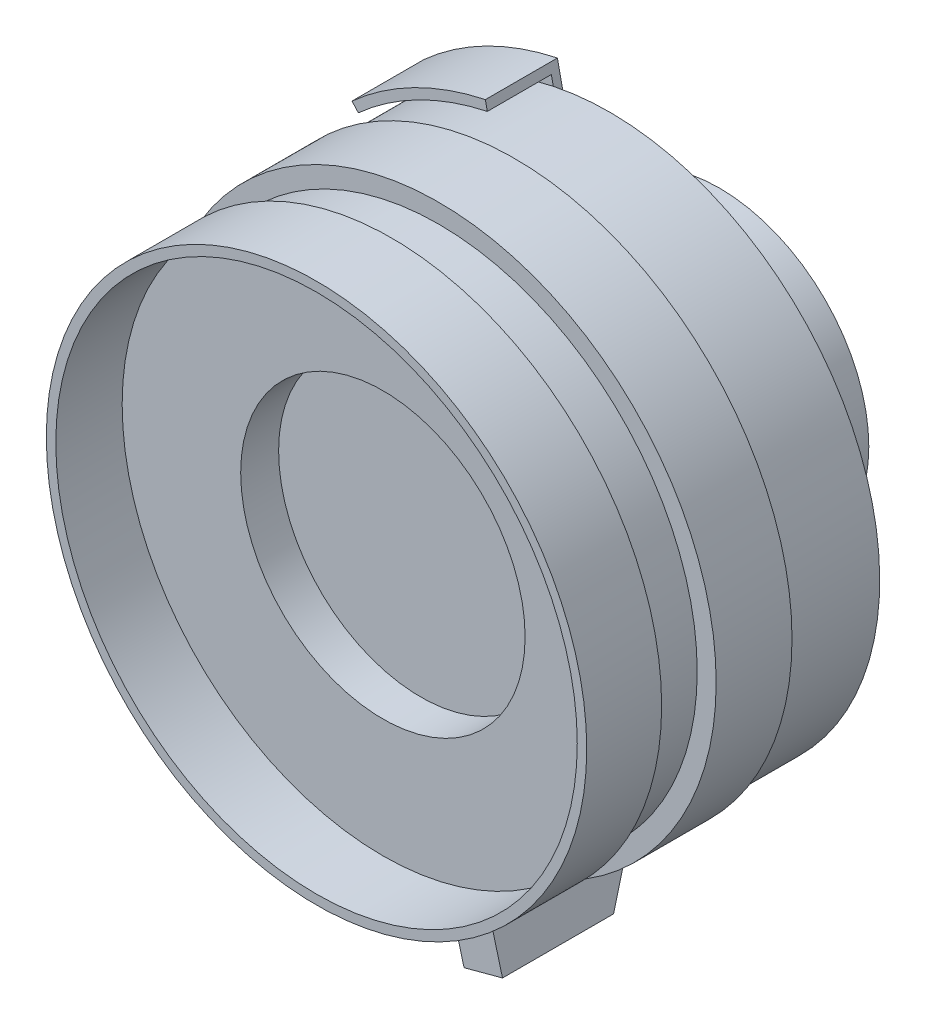
from build123d import *

# Parameters (mm, degrees)
SKETCH_1_R          = 15.75
EXTRUDE_1_DEPTH     = 4.5
SKETCH_2_R          = 16.3
EXTRUDE_2_DEPTH     = 6
SKETCH_3_R          = 19
EXTRUDE_3_DEPTH     = 0.5
SKETCH_4_R          = 24
EXTRUDE_4_DEPTH     = 0.6
SKETCH_5_R          = 28.5
EXTRUDE_5_DEPTH     = 10
SKETCH_6_R          = 0.8
EXTRUDE_6_DEPTH     = 1.2
SKETCH_7_R          = 29.25
EXTRUDE_7_DEPTH     = 8
SKETCH_8_R          = 27.25
EXTRUDE_8_DEPTH     = 5
SKETCH_9_R          = 28.5
EXTRUDE_9_DEPTH     = 7.9
SKETCH_10_R         = 14.75
CUT_EXTRUDE_1_DEPTH = 1
SKETCH_11_R         = 27.5
CUT_EXTRUDE_2_DEPTH = 7
SKETCH_12_R         = 15
CUT_EXTRUDE_3_DEPTH = 4
EXTRUDE_10_DEPTH    = 0.85
EXTRUDE_START       = 6.75
EXTRUDE_11_DEPTH    = 6.75
EXTRUDE_12_DEPTH    = 8.6
EXTRUDE_16_DEPTH    = 4.2


with BuildPart() as part:
    # 草图1 → 凸台-拉伸1 (new body)
    with BuildSketch(Plane.XY):
        Circle(SKETCH_1_R)
    extrude(amount=EXTRUDE_1_DEPTH)

    # 草图2 → 凸台-拉伸2 (add)
    with BuildSketch(Plane.XY.offset(4.5)):
        Circle(SKETCH_2_R)
    extrude(amount=EXTRUDE_2_DEPTH)

    # 草图3 → 凸台-拉伸3 (add)
    with BuildSketch(Plane.XY.offset(10.5)):
        Circle(SKETCH_3_R)
    extrude(amount=EXTRUDE_3_DEPTH)

    # 草图4 → 凸台-拉伸4 (add)
    with BuildSketch(Plane.XY.offset(11)):
        Circle(SKETCH_4_R)
    extrude(amount=EXTRUDE_4_DEPTH)

    # 草图5 → 凸台-拉伸5 (add)
    with BuildSketch(Plane.XY.offset(11.6)):
        Circle(SKETCH_5_R)
    extrude(amount=EXTRUDE_5_DEPTH)

    # 草图6 → 凸台-拉伸6 (add)
    with BuildSketch(Plane(origin=(0, 0, 10.5), x_dir=(-1, 0, 0), z_dir=(0, 0, -1))):
        with Locations(Location((4.658742812, 17.386664873, 0), (0, 0, 180))):
            Circle(SKETCH_6_R)
    extrude(amount=EXTRUDE_6_DEPTH)

    # 草图7 → 凸台-拉伸7 (add)
    with BuildSketch(Plane.XY.offset(21.6)):
        Circle(SKETCH_7_R)
    extrude(amount=EXTRUDE_7_DEPTH)

    # 草图8 → 凸台-拉伸8 (add)
    with BuildSketch(Plane.XY.offset(29.6)):
        Circle(SKETCH_8_R)
    extrude(amount=EXTRUDE_8_DEPTH)

    # 草图9 → 凸台-拉伸9 (add)
    with BuildSketch(Plane.XY.offset(34.6)):
        Circle(SKETCH_9_R)
    extrude(amount=EXTRUDE_9_DEPTH)

    # 草图10 → 切除-拉伸1 (cut)
    with BuildSketch(Plane(origin=(0, 0, 0), x_dir=(-1, 0, 0), z_dir=(0, 0, -1))):
        Circle(SKETCH_10_R)
    extrude(amount=-CUT_EXTRUDE_1_DEPTH, mode=Mode.SUBTRACT)

    # 草图11 → 切除-拉伸2 (cut)
    with BuildSketch(Plane.XY.offset(42.5)):
        Circle(SKETCH_11_R)
    extrude(amount=-CUT_EXTRUDE_2_DEPTH, mode=Mode.SUBTRACT)

    # 草图12 → 切除-拉伸3 (cut)
    with BuildSketch(Plane.XY.offset(35.5)):
        Circle(SKETCH_12_R)
    extrude(amount=-CUT_EXTRUDE_3_DEPTH, mode=Mode.SUBTRACT)

    # 草图13 → 凸台-拉伸10 (add)
    with BuildSketch(Plane(origin=(0, 0, 11.6), x_dir=(-1, 0, 0), z_dir=(0, 0, -1))):
        with BuildLine():
            Line((6.34130657, 29.833501822), (5.093836425, 23.964616218))
            ThreePointArc((5.093836425, 23.964616218), (11.122767244, 21.829659843), (16.393699856, 18.207048224))
            Line((16.393699856, 18.207048224), (20.408483494, 22.665917177))
            ThreePointArc((20.408483494, 22.665917177), (13.846710242, 27.175698988), (6.34130657, 29.833501822))
        make_face()
    extrude(amount=EXTRUDE_10_DEPTH)

    # 草图14 → 凸台-拉伸11 (add)
    with BuildSketch(Plane.XY.offset(11.6).offset(EXTRUDE_START)):
        with BuildLine():
            Line((-20.408483494, 22.665917177), (-19.739352888, 21.922772352))
            ThreePointArc((-19.739352888, 21.922772352), (-13.392719742, 26.284692464), (-6.133394879, 28.855354222))
            Line((-6.133394879, 28.855354222), (-6.34130657, 29.833501822))
            ThreePointArc((-6.34130657, 29.833501822), (-13.846710242, 27.175698988), (-20.408483494, 22.665917177))
        make_face()
    extrude(amount=-EXTRUDE_11_DEPTH)

    # 草图15 → 凸台-拉伸12 (add)
    with BuildSketch(Plane(origin=(0, 0, 11), x_dir=(-1, 0, 0), z_dir=(0, 0, -1))):
        with BuildLine():
            Line((-8.216276628, -22.549784885), (-9.922425111, -28.917217707))
            Line((-9.922425111, -28.917217707), (-5.86553664, -30.004257697))
            Line((-5.86553664, -30.004257697), (-4.159388158, -23.636824875))
            ThreePointArc((-4.159388158, -23.636824875), (-6.211657082, -23.182219831), (-8.216276628, -22.549784885))
        make_face()
    extrude(amount=-EXTRUDE_12_DEPTH)

    # 草图16 → 凸台-拉伸16 (add)
    with BuildSketch(Plane(origin=(2.028444235, 0.543519995, 0), x_dir=(0, 0, -1), z_dir=(0.9659258262890674, 0.25881904510252446, 0))):
        Polygon((-34.1, -25.25), (-34.1, -35.5), (-22.386751346, -35.5), (-19.5, -30.5), (-19.5, -29.75), (-30.1, -29.75), (-30.1, -25.25), align=None)
    extrude(amount=-EXTRUDE_16_DEPTH)


solid = part.part
